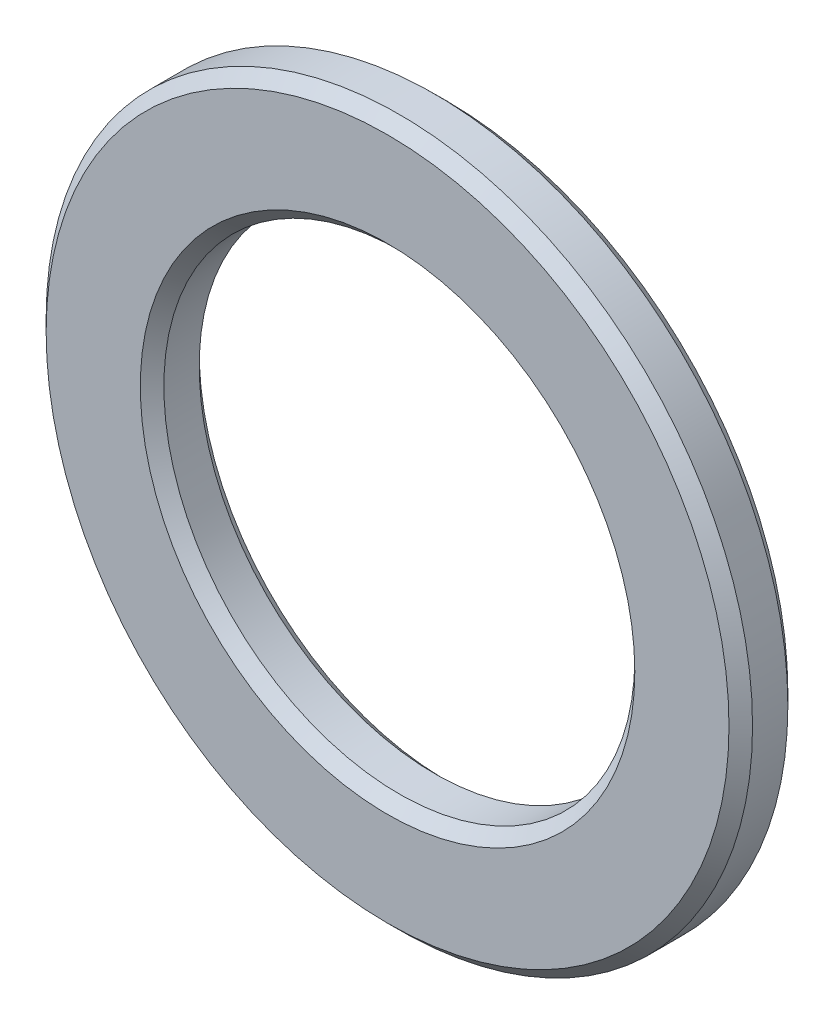
from build123d import *

# Parameters (mm, degrees)
SKETCH_1_R      = 3
SKETCH_1_R_2    = 2
EXTRUDE_1_DEPTH = 0.25
CHAMFER_1_SIZE  = 0.1


with BuildPart() as part:
    # 草图1 → 凸台-拉伸1 (new, symmetric)
    with BuildSketch(Plane.XY):
        Circle(SKETCH_1_R)
        Circle(SKETCH_1_R_2, mode=Mode.SUBTRACT)
    extrude(amount=EXTRUDE_1_DEPTH, both=True)

    # 倒角1
    chamfer_1_edges = [part.edges().sort_by_distance(p)[0] for p in [
        (-3, 0, -0.25),
        (-3, 0, 0.25),
        (-2, 0, -0.25),
        (-2, 0, 0.25),
    ]]
    chamfer(chamfer_1_edges, length=CHAMFER_1_SIZE)


solid = part.part
